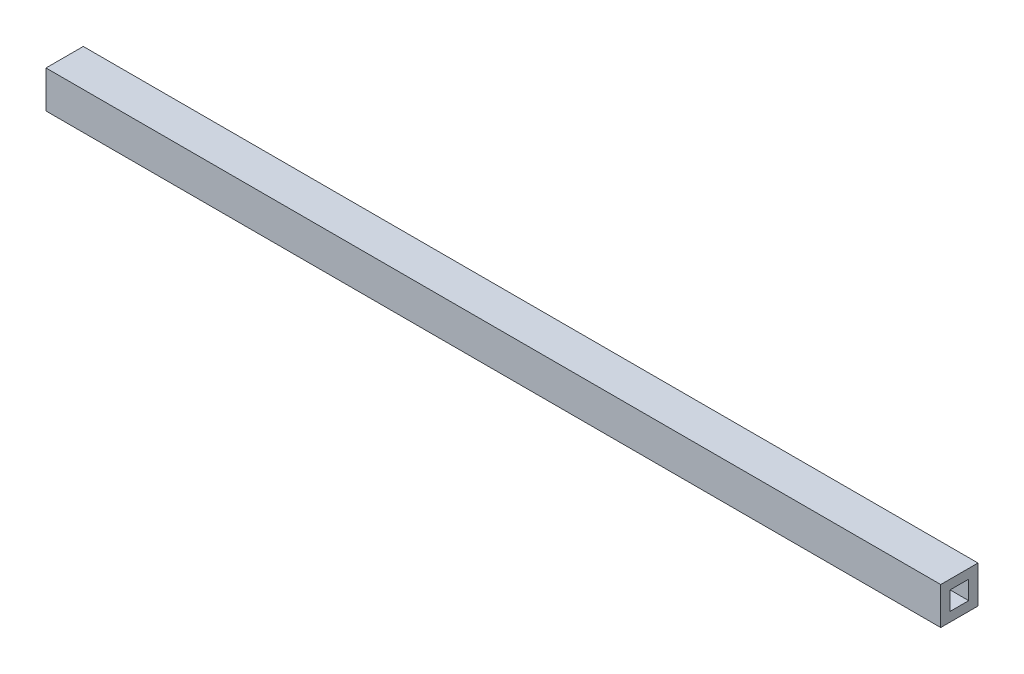
from build123d import *

# Parameters (mm, degrees)
SKETCH1_W           = 609.6
SKETCH1_H           = 25.4
BOSS_EXTRUDE1_DEPTH = 25.4
SKETCH2_W           = 12.742108998
SKETCH2_H           = 12.7
CUT_EXTRUDE1_DEPTH  = 611.261099858


with BuildPart() as part:
    # Sketch1 → Boss-Extrude1 (new body)
    with BuildSketch(Plane.XY):
        Rectangle(SKETCH1_W, SKETCH1_H)
    extrude(amount=BOSS_EXTRUDE1_DEPTH)

    # Sketch2 → Cut-Extrude1 (cut, through all)
    with BuildSketch(Plane(origin=(304.8, 0, 0), x_dir=(0, 0, -1), z_dir=(1, 0, 0))):
        with Locations((-12.7, 0)):
            Rectangle(SKETCH2_W, SKETCH2_H)
    extrude(amount=-CUT_EXTRUDE1_DEPTH, mode=Mode.SUBTRACT)


solid = part.part
